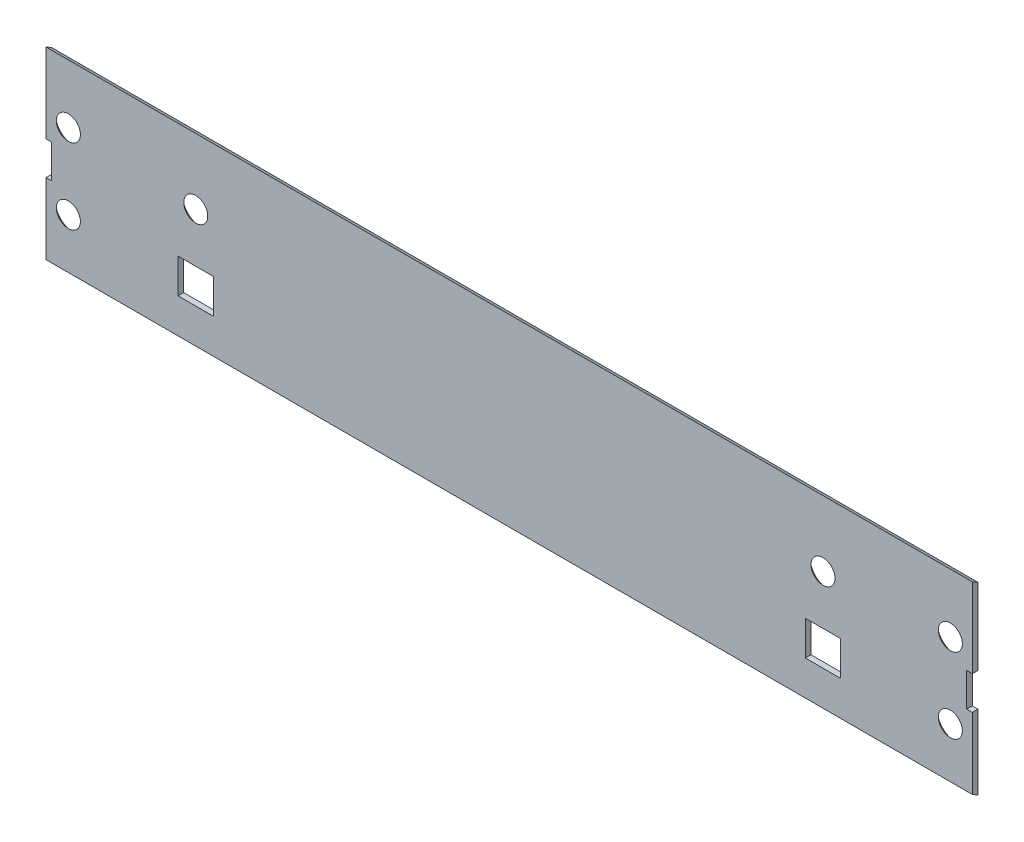
from build123d import *

# Parameters (mm, degrees)
SKETCH1_W                                 = 175.514
SKETCH1_H                                 = 35.5092
BOSS_EXTRUDE1_DEPTH                       = 1.0668
CUT_EXTRUDE2_DEPTH                        = 177.412947596
SKETCH8_W                                 = 6.7056
SKETCH8_H                                 = 6.5278
SKETCH8_W_2                               = 6.35
SKETCH8_H_2                               = 6.1722
SKETCH8_W_3                               = 1.0668
SKETCH8_H_3                               = 6.35
CUT_EXTRUDE3_DEPTH                        = 90.541358781
CSK_FOR_6_FLAT_HEAD_MACHINE_SCREW_2_COUNT = 2
CSK_FOR_6_FLAT_HEAD_MACHINE_SCREW_2_PITCH = 24.166931253
CSK_FOR_6_FLAT_HEAD_MACHINE_SCREW_3_COUNT = 2
CSK_FOR_6_FLAT_HEAD_MACHINE_SCREW_3_PITCH = 27.386313674
CSK_FOR_6_FLAT_HEAD_MACHINE_SCREW_4_COUNT = 2
CSK_FOR_6_FLAT_HEAD_MACHINE_SCREW_4_PITCH = 118.84025
CSK_FOR_6_FLAT_HEAD_MACHINE_SCREW_5_COUNT = 2
CSK_FOR_6_FLAT_HEAD_MACHINE_SCREW_5_PITCH = 142.976487796
CSK_FOR_6_FLAT_HEAD_MACHINE_SCREW_6_COUNT = 2
CSK_FOR_6_FLAT_HEAD_MACHINE_SCREW_6_PITCH = 143.555722815


with BuildPart() as part:
    # Sketch1 → Boss-Extrude1 (new body)
    with BuildSketch(Plane.XY):
        Rectangle(SKETCH1_W, SKETCH1_H)
    extrude(amount=BOSS_EXTRUDE1_DEPTH)

    # Sketch7 → Cut-Extrude2 (cut, through all)
    with BuildSketch(Plane.ZY.offset(87.757)):
        Polygon((0, 17.138682733), (1.0668, 17.7546), (0, 17.7546), align=None)
        Polygon((0, -17.7546), (1.0668, -17.138682733), (1.0668, -17.7546), align=None)
    extrude(amount=-CUT_EXTRUDE2_DEPTH, mode=Mode.SUBTRACT)

    # Sketch8 → Cut-Extrude3 (cut, through all)
    # profile 1 of 4: a face of its own
    with BuildSketch(Plane(origin=(0, 0, 0), x_dir=(-1, 0, 0), z_dir=(0, 0, -1))):
        with Locations((59.3852, -7.303463684)):
            Rectangle(SKETCH8_W, SKETCH8_H)
        with Locations((59.3852, -7.303463684)):
            Rectangle(SKETCH8_W_2, SKETCH8_H_2, mode=Mode.SUBTRACT)
    # profile 2 of 4: a face of its own
    with BuildSketch(Plane(origin=(0, 0, 0), x_dir=(-1, 0, 0), z_dir=(0, 0, -1))):
        with Locations((-87.2236, -0.494716366)):
            Rectangle(SKETCH8_W_3, SKETCH8_H_3)
    # profile 3 of 4: a face of its own
    with BuildSketch(Plane(origin=(0, 0, 0), x_dir=(-1, 0, 0), z_dir=(0, 0, -1))):
        with Locations((-59.45505, -7.303467884)):
            Rectangle(SKETCH8_W, SKETCH8_H)
        with Locations((-59.45505, -7.303467884)):
            Rectangle(SKETCH8_W_2, SKETCH8_H_2, mode=Mode.SUBTRACT)
    # profile 4 of 4: a face of its own
    with BuildSketch(Plane(origin=(0, 0, 0), x_dir=(-1, 0, 0), z_dir=(0, 0, -1))):
        with Locations((87.29345, -0.494712166)):
            Rectangle(SKETCH8_W_3, SKETCH8_H_3)
    extrude(amount=-CUT_EXTRUDE3_DEPTH, mode=Mode.SUBTRACT)


with BuildPart() as cut_extrude3_kept_piece:
    # of the separate pieces the step leaves, the one the design keeps (cut_extrude3_pieces_kept)
    add(part.part.solids().sort_by_distance((-87.757, -17.138682733, 1.0668))[0])

    # Sketch9 → CSK for #6 Flat Head Machine Screw (100)1 (revolve, cut)
    with BuildSketch(Plane(origin=(59.45505, 5.307632116, 0), x_dir=(0, 1, 0), z_dir=(1, 0, 0))):
        Polygon((0, 0), (0, 1.0668), (1.89865, 1.0668), (1.89865, 1.380025208), (3.5433, 0), align=None)
    csk_for_6_flat_head_machine_screw_100 = revolve(axis=Axis((59.45505, 5.307632116, -6.35), (0, 0, 1)), mode=Mode.SUBTRACT)

    # CSK for _6 Flat Head Machine Screw _ 2: CSK for #6 Flat Head Machine Screw (100)1 ×2
    with Locations(*[Vector(0.9984718269541709, 0.05526310504125029, 0) * (i * CSK_FOR_6_FLAT_HEAD_MACHINE_SCREW_2_PITCH) for i in range(1, CSK_FOR_6_FLAT_HEAD_MACHINE_SCREW_2_COUNT)]):
        add(csk_for_6_flat_head_machine_screw_100, mode=Mode.SUBTRACT)

    # CSK for _6 Flat Head Machine Screw _ 3: CSK for #6 Flat Head Machine Screw (100)1 ×2
    with Locations(*[Vector(0.881097043122147, -0.4729355142103514, 0) * (i * CSK_FOR_6_FLAT_HEAD_MACHINE_SCREW_3_PITCH) for i in range(1, CSK_FOR_6_FLAT_HEAD_MACHINE_SCREW_3_COUNT)]):
        add(csk_for_6_flat_head_machine_screw_100, mode=Mode.SUBTRACT)

    # CSK for _6 Flat Head Machine Screw _ 4: CSK for #6 Flat Head Machine Screw (100)1 ×2
    with Locations(*[(-i * CSK_FOR_6_FLAT_HEAD_MACHINE_SCREW_4_PITCH, 0, 0) for i in range(1, CSK_FOR_6_FLAT_HEAD_MACHINE_SCREW_4_COUNT)]):
        add(csk_for_6_flat_head_machine_screw_100, mode=Mode.SUBTRACT)

    # CSK for _6 Flat Head Machine Screw _ 5: CSK for #6 Flat Head Machine Screw (100)1 ×2
    with Locations(*[Vector(-0.9999563718759208, 0.009341003412130584, 0) * (i * CSK_FOR_6_FLAT_HEAD_MACHINE_SCREW_5_PITCH) for i in range(1, CSK_FOR_6_FLAT_HEAD_MACHINE_SCREW_5_COUNT)]):
        add(csk_for_6_flat_head_machine_screw_100, mode=Mode.SUBTRACT)

    # CSK for _6 Flat Head Machine Screw _ 6: CSK for #6 Flat Head Machine Screw (100)1 ×2
    with Locations(*[Vector(-0.9959216337502219, -0.09022249956795243, 0) * (i * CSK_FOR_6_FLAT_HEAD_MACHINE_SCREW_6_PITCH) for i in range(1, CSK_FOR_6_FLAT_HEAD_MACHINE_SCREW_6_COUNT)]):
        add(csk_for_6_flat_head_machine_screw_100, mode=Mode.SUBTRACT)


solid = cut_extrude3_kept_piece.part
